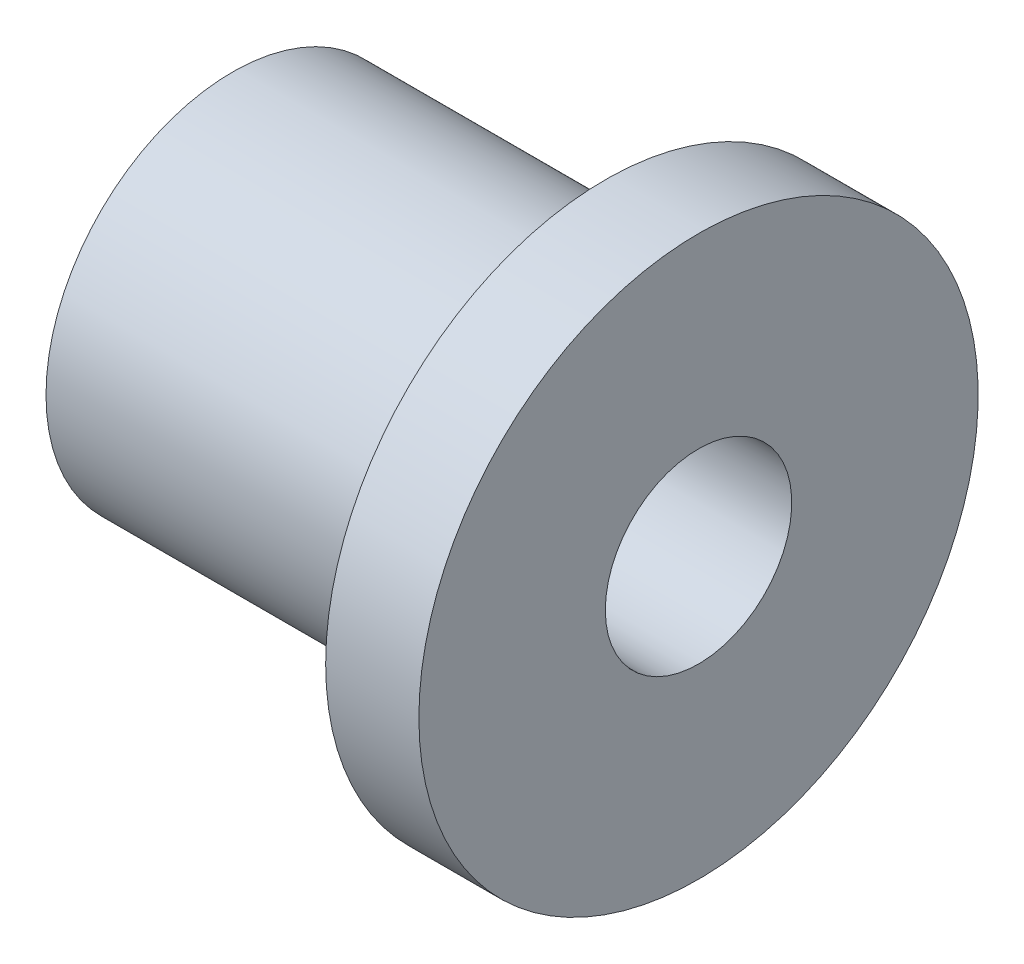
from build123d import *


with BuildPart() as part:
    # Sketch1 → Revolve1 (revolve)
    with BuildSketch(Plane.XY, mode=Mode.PRIVATE) as revolve1_sk:
        Polygon((0, 3.175), (0, 6.35), (12.7, 6.35), (12.7, 9.525), (15.875, 9.525), (15.875, 3.175), align=None)
    revolve(revolve1_sk.sketch.rotate(Axis((0, 0, 0), (1, 0, 0)), 90), axis=Axis((0, 0, 0), (1, 0, 0)))


solid = part.part
